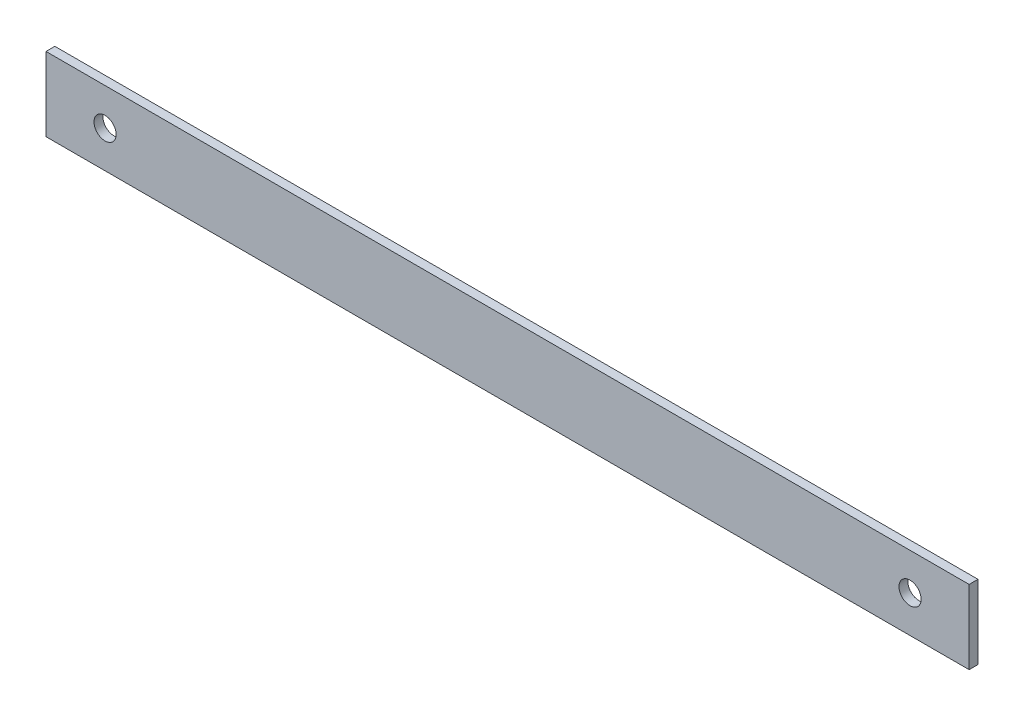
from build123d import *

# Parameters (mm, degrees)
SKETCH1_W           = 125
SKETCH1_H           = 10
BOSS_EXTRUDE1_DEPTH = 1.2
SKETCH2_R           = 1.5
CUT_EXTRUDE1_DEPTH  = 5


with BuildPart() as part:
    # Sketch1 → Boss-Extrude1 (new body)
    with BuildSketch(Plane.XY):
        with Locations((62.5, 5)):
            Rectangle(SKETCH1_W, SKETCH1_H)
    extrude(amount=BOSS_EXTRUDE1_DEPTH)

    # Sketch2 → Cut-Extrude1 (cut, symmetric)
    with BuildSketch(Plane.XY):
        with Locations((8, 5)):
            Circle(SKETCH2_R)
        with Locations((117, 5)):
            Circle(SKETCH2_R)
    extrude(amount=CUT_EXTRUDE1_DEPTH, both=True, mode=Mode.SUBTRACT)


solid = part.part
